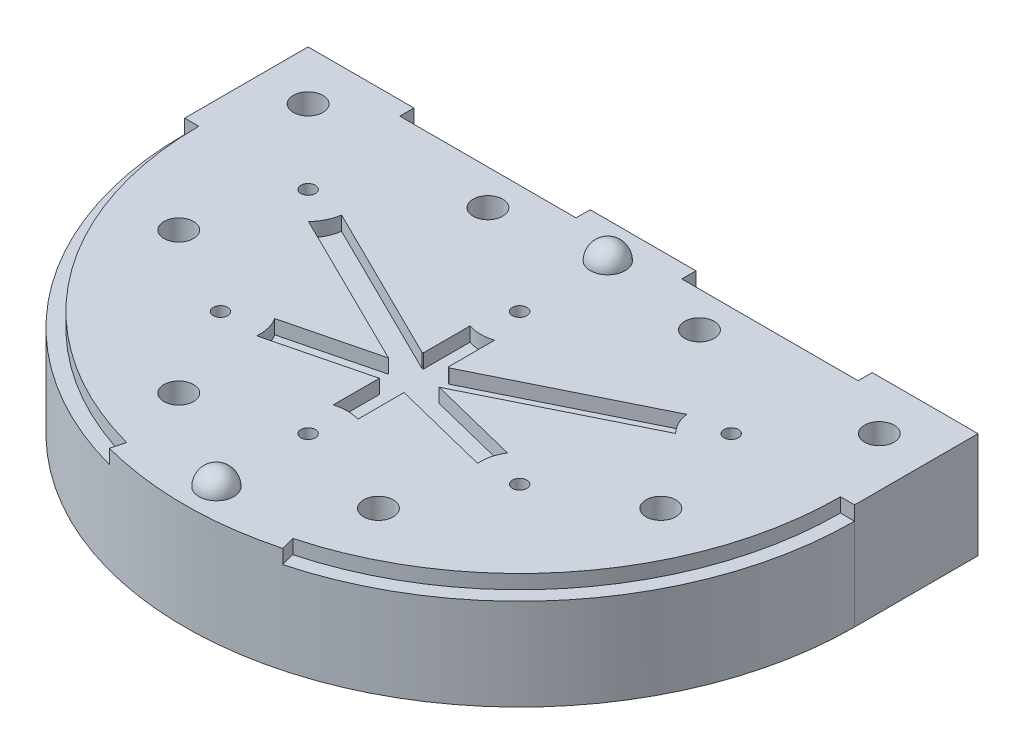
from build123d import *

# Parameters (mm, degrees)
BOSS_EXTRUDE1_DEPTH      = 15
CUT_EXTRUDE1_DEPTH       = 2
M2_5X0_45_TAPPED_HOLE1_D = 2.05
CUT_EXTRUDE2_START       = -2
SKETCH9_W                = 25
SKETCH9_H                = 2
CUT_EXTRUDE2_DEPTH       = 2
M5X0_8_TAPPED_HOLE1_D    = 4.2


with BuildPart() as part:
    # Sketch1 → Boss-Extrude1 (new body)
    with BuildSketch(Plane(origin=(0, 0, 0), x_dir=(1, 0, 0), z_dir=(0, 1, 0))):
        with BuildLine():
            Line((-47.5, 17.5), (47.5, 17.5))
            Line((47.5, 17.5), (47.5, 0))
            ThreePointArc((47.5, 0), (33.587572106, -33.587572106), (0, -47.5))
            ThreePointArc((0, -47.5), (-33.587572106, -33.587572106), (-47.5, 0))
            Line((-47.5, 0), (-47.5, 17.5))
        make_face()
    extrude(amount=BOSS_EXTRUDE1_DEPTH)

    # Sketch2 → Cut-Extrude1 (cut)
    with BuildSketch(Plane(origin=(0, 15, 0), x_dir=(1, 0, 0), z_dir=(0, 1, 0))):
        with BuildLine():
            Line((13.71356205, -21.139861194), (1.75, -18.14509732))
            Line((1.75, -18.14509732), (1.75, -22.707023927))
            Line((1.75, -22.707023927), (1.75, -24.707023927))
            ThreePointArc((1.75, -24.707023927), (0, -24.425226847), (-1.75, -24.707023927))
            Line((-1.75, -24.707023927), (-1.75, -22.707023927))
            Line((-1.75, -22.707023927), (-1.75, -18.14509732))
            Line((-1.75, -18.14509732), (-13.71356205, -21.139861194))
            Line((-13.71356205, -21.139861194), (-15.653699161, -21.625523616))
            ThreePointArc((-15.653699161, -21.625523616), (-15.805291295, -19.859474518), (-16.503608401, -18.230283671))
            Line((-16.503608401, -18.230283671), (-14.56347129, -17.744621249))
            Line((-14.56347129, -17.744621249), (-3.599185624, -15))
            Line((-3.599185624, -15), (-24.237297726, -4.800131508))
            Line((-24.237297726, -4.800131508), (-26.03027479, -3.913997633))
            ThreePointArc((-26.03027479, -3.913997633), (-25.002279798, -2.469997671), (-24.479540508, -0.77628777))
            Line((-24.479540508, -0.77628777), (-22.686563443, -1.662421645))
            Line((-22.686563443, -1.662421645), (-1.893248081, -11.93899545))
            Line((-1.893248081, -11.93899545), (-1.75, -11.85490268))
            Line((-1.75, -11.85490268), (-1.75, -7.292976073))
            Line((-1.75, -7.292976073), (-1.75, -5.292976073))
            ThreePointArc((-1.75, -5.292976073), (0, -5.574773153), (1.75, -5.292976073))
            Line((1.75, -5.292976073), (1.75, -7.292976073))
            Line((1.75, -7.292976073), (1.75, -11.85490268))
            Line((1.75, -11.85490268), (1.893248081, -11.93899545))
            Line((1.893248081, -11.93899545), (22.686563443, -1.662421645))
            Line((22.686563443, -1.662421645), (24.479540508, -0.77628777))
            ThreePointArc((24.479540508, -0.77628777), (25.002279798, -2.469997671), (26.03027479, -3.913997633))
            Line((26.03027479, -3.913997633), (24.237297726, -4.800131508))
            Line((24.237297726, -4.800131508), (3.599185624, -15))
            Line((3.599185624, -15), (14.56347129, -17.744621249))
            Line((14.56347129, -17.744621249), (16.503608401, -18.230283671))
            ThreePointArc((16.503608401, -18.230283671), (15.805291295, -19.859474518), (15.653699161, -21.625523616))
            Line((15.653699161, -21.625523616), (13.71356205, -21.139861194))
        make_face()
    extrude(amount=-CUT_EXTRUDE1_DEPTH, mode=Mode.SUBTRACT)

    # M2.5x0.45 Tapped Hole1 (through all)
    with Locations(Plane(origin=(0, 15, 0), x_dir=(1, 0, 0), z_dir=(0, 1, 0))):
        with Locations((-30, 0), (0, 0), (30, 0), (21.213203436, -21.213203436), (0, -30), (-21.213203436, -21.213203436)):
            Hole(M2_5X0_45_TAPPED_HOLE1_D / 2)

    # Sketch9 → Cut-Extrude2 (cut)
    with BuildSketch(Plane(origin=(0, 15, 0), x_dir=(1, 0, 0), z_dir=(0, 1, 0)).offset(CUT_EXTRUDE2_START)):
        with Locations((-20, 16.5)):
            Rectangle(SKETCH9_W, SKETCH9_H)
        with Locations((20, 16.5)):
            Rectangle(SKETCH9_W, SKETCH9_H)
        with BuildLine():
            Line((11.776266552, -43.949625096), (12.293904642, -45.881476749))
            ThreePointArc((12.293904642, -45.881476749), (37.684283664, -28.916167878), (47.5, 0))
            Line((47.5, 0), (45.5, 0))
            ThreePointArc((45.5, 0), (36.097576983, -27.69864502), (11.776266552, -43.949625096))
        make_face()
        with BuildLine():
            Line((-47.5, 0), (-45.5, 0))
            ThreePointArc((-45.5, 0), (-36.097576983, -27.69864502), (-11.776266552, -43.949625096))
            Line((-11.776266552, -43.949625096), (-12.293904642, -45.881476749))
            ThreePointArc((-12.293904642, -45.881476749), (-37.684283664, -28.916167878), (-47.5, 0))
        make_face()
    extrude(amount=CUT_EXTRUDE2_DEPTH, mode=Mode.SUBTRACT)

    # M5x0.8 Tapped Hole1 (through all)
    with Locations(Plane(origin=(0, 15, 0), x_dir=(1, 0, 0), z_dir=(0, 1, 0))):
        with Locations((-40.5, 10.5), (-34.183542703, -14.159286998), (34.183542703, -14.159286998), (-14.159286998, -34.183542703), (14.159286998, -34.183542703), (40.5, 10.5), (-15, 10.5), (15, 10.5)):
            Hole(M5X0_8_TAPPED_HOLE1_D / 2)

    # Sketch15 → Revolve2 (revolve)
    with BuildSketch(Plane(origin=(0, 0, 0), x_dir=(0, 0, -1), z_dir=(1, 0, 0))):
        with BuildLine():
            Line((-43, 17.4746), (-43, 15))
            Line((-43, 15), (-40.5254, 15))
            ThreePointArc((-40.5254, 15), (-41.250193559, 16.749806441), (-43, 17.4746))
        make_face()
    revolve(axis=Axis((0, 15, 43), (0, 1, 0)))

    # Sketch17 → Revolve3 (revolve)
    with BuildSketch(Plane(origin=(0, 0, 0), x_dir=(0, 0, -1), z_dir=(1, 0, 0))):
        with BuildLine():
            Line((14.9746, 15), (12.5, 15))
            Line((12.5, 15), (12.5, 17.4746))
            ThreePointArc((12.5, 17.4746), (14.249806441, 16.749806441), (14.9746, 15))
        make_face()
    revolve(axis=Axis((0, 15, -12.5), (0, 1, 0)))


solid = part.part
